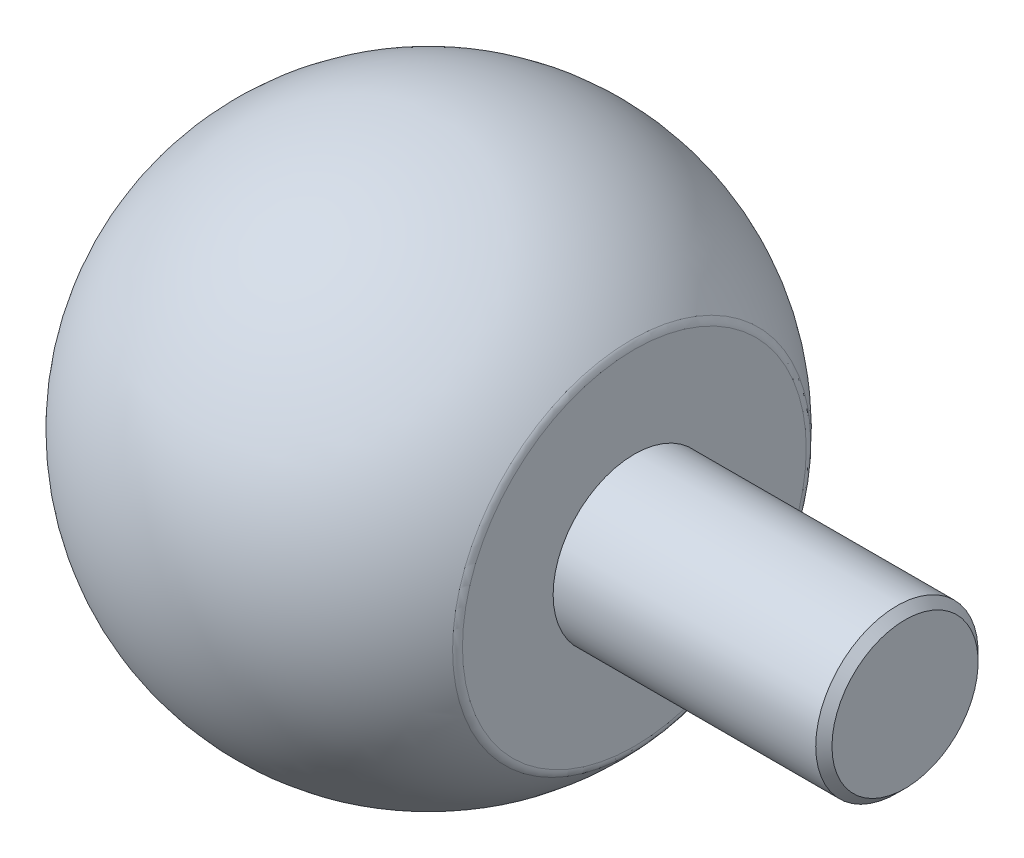
from build123d import *

# Parameters (mm, degrees)
SKETCH_6_R             = 2
CUT_EXTRUDE_1_DEPTH    = 0.2
SKETCH_6_2_R           = 2
CUT_EXTRUDE_2_DEPTH    = 5
HOLE_WIZARD_M3_1_D     = 2.5
HOLE_WIZARD_M3_1_DEPTH = 5.5
HOLE_WIZARD_M3_1_TIP   = 0.751075774
SKETCH_10_R            = 10.599002553
CUT_EXTRUDE_3_DEPTH    = 10
SKETCH_11_R            = 1.5
EXTRUDE_1_DEPTH        = 5
FILLET_1_R             = 0.2
CHAMFER_1_SIZE         = 0.15


with BuildPart() as part:
    # 草图1 → 旋转1 (revolve)
    with BuildSketch(Plane.XY):
        with BuildLine():
            Line((0, 5), (0, -5))
            ThreePointArc((0, -5), (5, 0), (0, 5))
        make_face()
    revolve(axis=Axis((0, 5, 0), (0, -1, 0)))

    # 草图6 → 切除-拉伸1 (cut)
    with BuildSketch(Plane(origin=(-0.316240488, -4.7, 0), x_dir=(0.9977440075226778, -0.06713341532044086, 0), z_dir=(-0.06713341532044086, -0.9977440075226779, 0))):
        Circle(SKETCH_6_R)
    extrude(amount=-CUT_EXTRUDE_1_DEPTH, mode=Mode.SUBTRACT)


with BuildPart() as cut_extrude_1_piece_1:
    # of the separate pieces the step leaves, piece 1, a body of its own (cut_extrude_1_pieces)
    add(part.part.solids().sort_by_distance((1.687844058, -4.706504269, 0))[0])

    # M3 螺纹孔1
    with Locations(Plane(origin=(-0.302813805, -4.500451198, 0), x_dir=(-0.997744007523, 0.06713341532, 0), z_dir=(-0.06713341532, -0.997744007523, 0))):
        with Locations((0, 0)):
            Hole(HOLE_WIZARD_M3_1_D / 2, depth=HOLE_WIZARD_M3_1_DEPTH)
            with Locations((0, 0, -(HOLE_WIZARD_M3_1_DEPTH + HOLE_WIZARD_M3_1_TIP / 2))):  # 118° drill point
                Cone(0, HOLE_WIZARD_M3_1_D / 2, HOLE_WIZARD_M3_1_TIP, mode=Mode.SUBTRACT)

    # 草图10 → 切除-拉伸3 (cut)
    with BuildSketch(Plane(origin=(3.8, 0, 0), x_dir=(0, 0, -1), z_dir=(1, 0, 0))):
        Circle(SKETCH_10_R)
    extrude(amount=CUT_EXTRUDE_3_DEPTH, mode=Mode.SUBTRACT)

    # 草图11 → 凸台-拉伸1 (add)
    with BuildSketch(Plane(origin=(3.8, 0, 0), x_dir=(0, 0, -1), z_dir=(1, 0, 0))):
        Circle(SKETCH_11_R)
    extrude(amount=EXTRUDE_1_DEPTH)

    # 圆角1
    fillet_1_edges = [cut_extrude_1_piece_1.edges().sort_by_distance(p)[0] for p in [
        (3.8, 0, -3.249615362),
    ]]
    fillet(fillet_1_edges, radius=FILLET_1_R)

    # 倒角1
    chamfer_1_edges = [cut_extrude_1_piece_1.edges().sort_by_distance(p)[0] for p in [
        (8.8, 0, 1.5),
    ]]
    chamfer(chamfer_1_edges, length=CHAMFER_1_SIZE)


with BuildPart() as cut_extrude_1_piece_2:
    # of the separate pieces the step leaves, piece 2, a body of its own (cut_extrude_1_pieces)
    add(part.part.solids().sort_by_distance((0, -5, 0))[0])

    # 草图6<2> → 切除-拉伸2 (cut)
    with BuildSketch(Plane(origin=(-0.316240488, -4.7, 0), x_dir=(0.9977440075226778, -0.06713341532044086, 0), z_dir=(-0.06713341532044086, -0.9977440075226779, 0))):
        Circle(SKETCH_6_2_R)
    extrude(amount=CUT_EXTRUDE_2_DEPTH, mode=Mode.SUBTRACT)


solid = cut_extrude_1_piece_1.part
